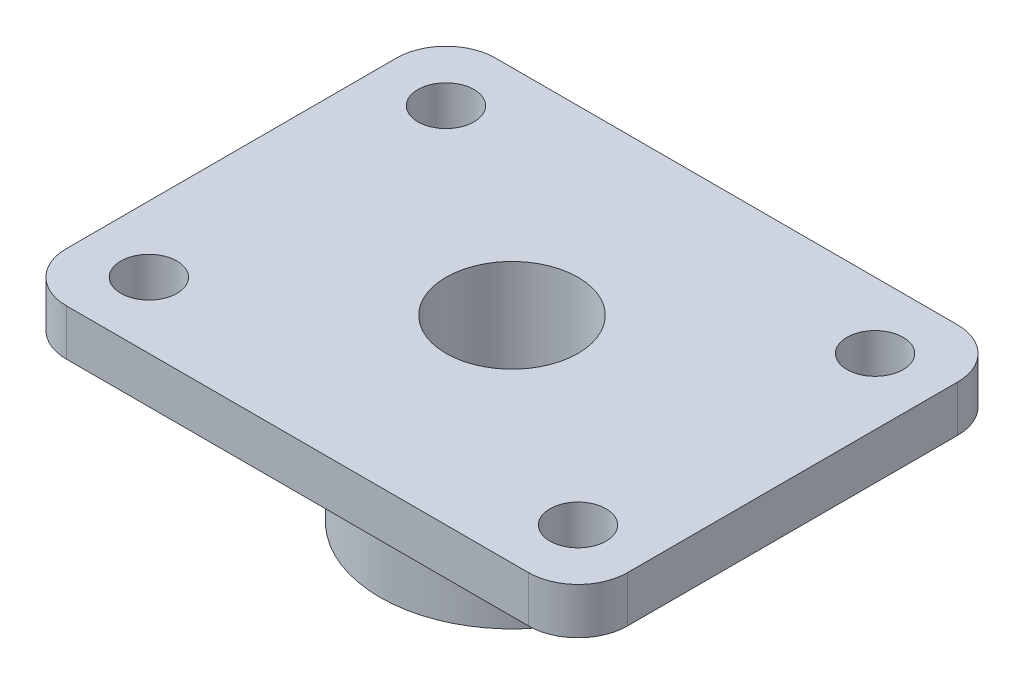
from build123d import *
from build123d.topology import SkipClean

# Parameters (mm, degrees)
SCHIZZO1_R                   = 20
SCHIZZO1_R_2                 = 8.5
ESTRUSIONE_ESTRUSIONE1_DEPTH = 14
ESTRUSIONE_ESTRUSIONE2_START = 40
SCHIZZO2_R                   = 40
SCHIZZO2_R_2                 = 20
ESTRUSIONE_ESTRUSIONE2_DEPTH = 40


with BuildPart() as part:
    # Schizzo1 → Estrusione-Estrusione1 (new body)
    with BuildSketch(Plane(origin=(0, 0, 0), x_dir=(1, 0, 0), z_dir=(0, 1, 0))):
        with BuildLine():
            Line((-70, 65), (70, 65))
            ThreePointArc((70, 65), (80.606601718, 60.606601718), (85, 50))
            Line((85, 50), (85, -50))
            ThreePointArc((85, -50), (80.606601718, -60.606601718), (70, -65))
            Line((70, -65), (-70, -65))
            ThreePointArc((-70, -65), (-80.606601718, -60.606601718), (-85, -50))
            Line((-85, -50), (-85, 50))
            ThreePointArc((-85, 50), (-80.606601718, 60.606601718), (-70, 65))
        make_face()
        with Locations(Location((0, 0, 0), (0, 0, 270))):
            Circle(SCHIZZO1_R, mode=Mode.SUBTRACT)
        with Locations(Location((65, -45, 0), (0, 0, 270))):
            Circle(SCHIZZO1_R_2, mode=Mode.SUBTRACT)
        with Locations(Location((65, 45, 0), (0, 0, 90))):
            Circle(SCHIZZO1_R_2, mode=Mode.SUBTRACT)
        with Locations(Location((-65, -45, 0), (0, 0, 90))):
            Circle(SCHIZZO1_R_2, mode=Mode.SUBTRACT)
        with Locations(Location((-65, 45, 0), (0, 0, 270))):
            Circle(SCHIZZO1_R_2, mode=Mode.SUBTRACT)
    extrude(amount=ESTRUSIONE_ESTRUSIONE1_DEPTH)

    # Schizzo2 → Estrusione-Estrusione2 (add)
    with SkipClean():  # the faces are left unmerged after this step: merging them gives an invalid solid
        with BuildSketch(Plane.XZ.offset(ESTRUSIONE_ESTRUSIONE2_START)):
            with Locations(Location((0, 0, 0), (0, 0, 90))):
                Circle(SCHIZZO2_R)
            with Locations(Location((0, 0, 0), (0, 0, 270))):
                Circle(SCHIZZO2_R_2, mode=Mode.SUBTRACT)
        extrude(amount=-ESTRUSIONE_ESTRUSIONE2_DEPTH)


solid = part.part
